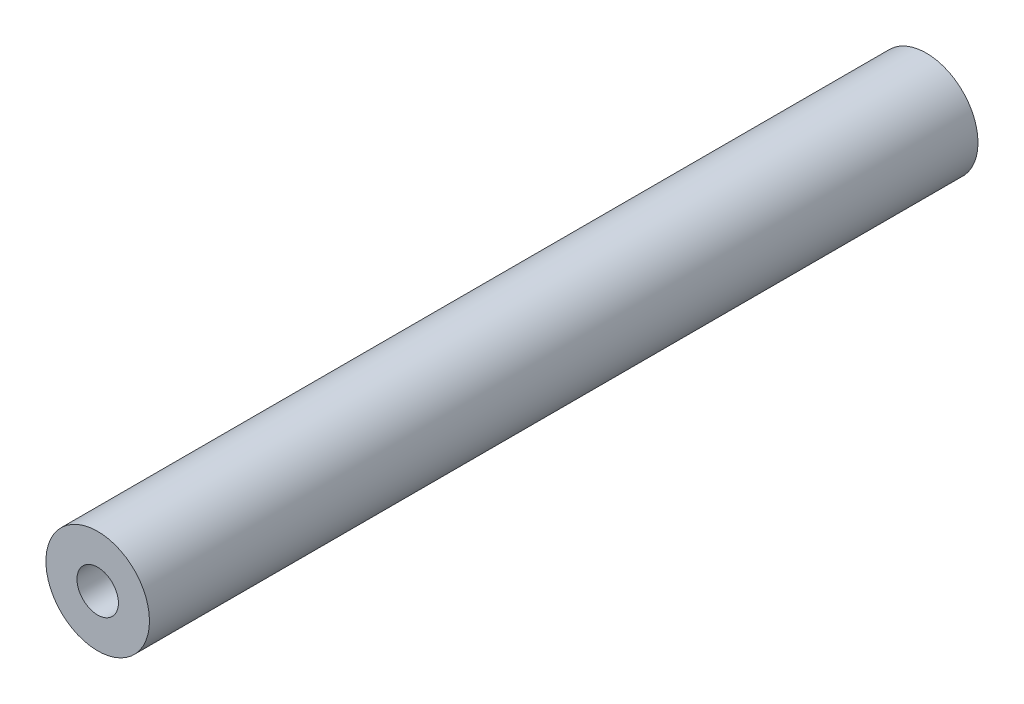
from build123d import *

# Parameters (mm, degrees)
SKETCH_1_R      = 4
SKETCH_1_R_2    = 1.6
EXTRUDE_1_DEPTH = 32


with BuildPart() as part:
    # 草图1 → 凸台-拉伸1 (new, symmetric)
    with BuildSketch(Plane.XY):
        Circle(SKETCH_1_R)
        Circle(SKETCH_1_R_2, mode=Mode.SUBTRACT)
    extrude(amount=EXTRUDE_1_DEPTH, both=True)


solid = part.part
